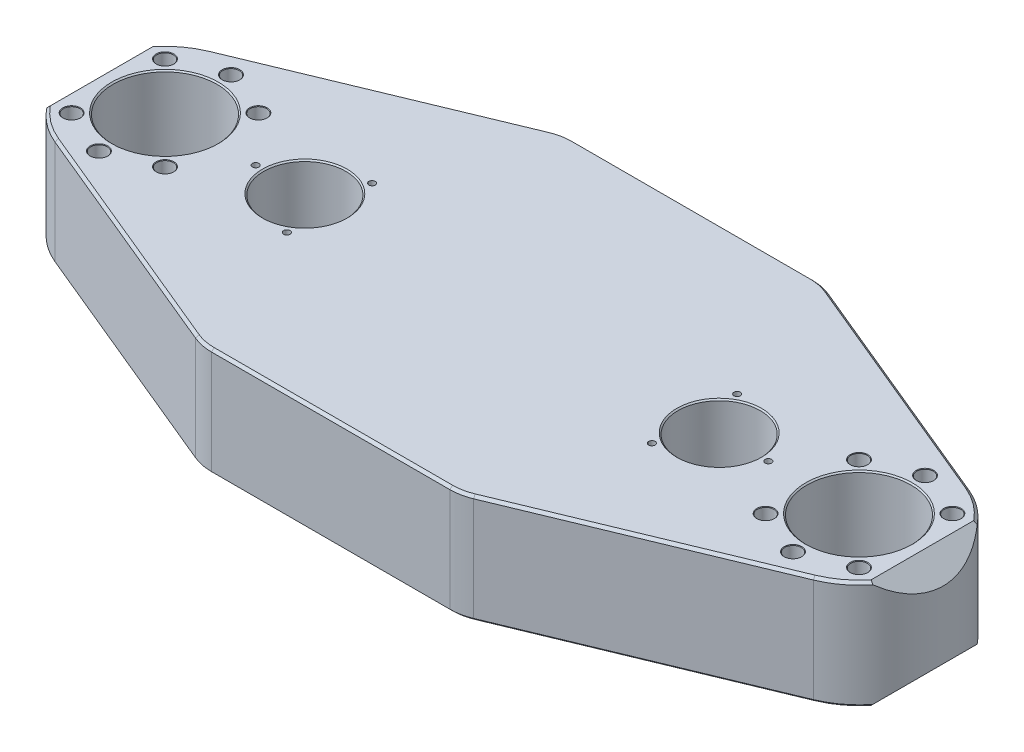
from build123d import *

# Parameters (mm, degrees)
SKETCH1_R                      = 20.1
SKETCH1_R_2                    = 15.875
BOSS_EXTRUDE1_DEPTH            = 21
CUT_EXTRUDE3_DEPTH             = 182.833027803
MIRROR2_COPY_1_DEPTH           = 182.833027803
M6_CLEARANCE_HOLE1_D           = 6.4
CHAMFER2_SIZE                  = 0.5
CHAMFER5_SIZE                  = 1
CHAMFER6_SIZE                  = 0.5
M3X0_5_TAPPED_HOLE1_AT_2_COUNT = 2
M3X0_5_TAPPED_HOLE1_AT_2_PITCH = 32.908965344
M3X0_5_TAPPED_HOLE1_AT_3_COUNT = 2
M3X0_5_TAPPED_HOLE1_AT_3_PITCH = 32.908965344
CHAMFER9_SIZE                  = 0.2


with BuildPart() as part:
    # Sketch1 → Boss-Extrude1 (new, symmetric)
    with BuildSketch(Plane(origin=(0, 0, 0), x_dir=(1, 0, 0), z_dir=(0, 1, 0))):
        with BuildLine():
            Line((-146.444734798, 30.022967472), (-53.677446084, 68.47567229))
            ThreePointArc((-53.677446084, 68.47567229), (-49.92341171, 69.615216616), (-46.019147746, 70))
            Line((-46.019147746, 70), (46.019147746, 70))
            ThreePointArc((46.019147746, 70), (49.92341171, 69.615216616), (53.677446084, 68.47567229))
            Line((53.677446084, 68.47567229), (146.444734798, 30.022967472))
            ThreePointArc((146.444734798, 30.022967472), (166.5, 0), (146.444734798, -30.022967472))
            Line((146.444734798, -30.022967472), (53.677446084, -68.47567229))
            ThreePointArc((53.677446084, -68.47567229), (49.92341171, -69.615216616), (46.019147746, -70))
            Line((46.019147746, -70), (-46.019147746, -70))
            ThreePointArc((-46.019147746, -70), (-49.92341171, -69.615216616), (-53.677446084, -68.47567229))
            Line((-53.677446084, -68.47567229), (-146.444734798, -30.022967472))
            ThreePointArc((-146.444734798, -30.022967472), (-166.5, 0), (-146.444734798, 30.022967472))
        make_face()
        with Locations(Location((-134, 0, 0), (0, 0, 90))):
            Circle(SKETCH1_R, mode=Mode.SUBTRACT)
        with Locations(Location((134, 0, 0), (0, 0, 90))):
            Circle(SKETCH1_R, mode=Mode.SUBTRACT)
        with Locations(Location((-80, 0, 0), (0, 0, 90))):
            Circle(SKETCH1_R_2, mode=Mode.SUBTRACT)
        with Locations(Location((80, 0, 0), (0, 0, 90))):
            Circle(SKETCH1_R_2, mode=Mode.SUBTRACT)
    extrude(amount=BOSS_EXTRUDE1_DEPTH, both=True)

    # Sketch5 → Cut-Extrude3 (cut, symmetric)
    with BuildSketch(Plane.XY):
        Polygon((158.5, -21), (166.5, -13), (166.5, -21), align=None)
    cut_extrude3 = extrude(amount=CUT_EXTRUDE3_DEPTH, both=True, mode=Mode.SUBTRACT)

    # Mirror1: Cut-Extrude3 across plane
    add(cut_extrude3.mirror(Plane.ZX), mode=Mode.SUBTRACT)

    # Mirror2: Cut-Extrude3 across plane
    add(cut_extrude3.mirror(Plane(origin=(0, 0, 0), x_dir=(0, 0, 1), z_dir=(1, 0, 0))), mode=Mode.SUBTRACT)

    # Mirror2 copy 1 sketch → Mirror2 copy 1 (cut, symmetric)
    with BuildSketch(Plane(origin=(0, 0, 0), x_dir=(-1, 0, 0), z_dir=(0, 0, 1))):
        Polygon((158.5, -21), (166.5, -13), (166.5, -21), align=None)
    extrude(amount=MIRROR2_COPY_1_DEPTH, both=True, mode=Mode.SUBTRACT)

    # M6 Clearance Hole1 (through all)
    with Locations(Plane(origin=(0, -21, 0), x_dir=(-1, 0, 0), z_dir=(0, -1, 0))):
        with Locations((-115.96877708, -18.03122292), (-134, -25.5), (-152.03122292, -18.03122292), (-152.03122292, 18.03122292), (-134, 25.5), (-115.96877708, 18.03122292)):
            m6_clearance_hole1 = Hole(M6_CLEARANCE_HOLE1_D / 2)

    # Mirror5: M6 Clearance Hole1 across plane
    add(m6_clearance_hole1.mirror(Plane(origin=(0, 0, 0), x_dir=(0, 0, 1), z_dir=(1, 0, 0))), mode=Mode.SUBTRACT)

    # Chamfer2
    chamfer2_edges = [part.edges().sort_by_distance(p)[0] for p in [
        (-134, -21, 20.1),
        (-134, 21, 20.1),
        (134, -21, 20.1),
        (134, 21, 20.1),
    ]]
    chamfer(chamfer2_edges, length=CHAMFER2_SIZE)

    # Chamfer5
    chamfer5_edges = [part.edges().sort_by_distance(p)[0] for p in [
        (152.974072526, -21, -26.386257252),
        (-152.974072526, -21, -26.386257252),
        (100.061090441, -21, -49.249319881),
        (-100.061090441, -21, -49.249319881),
        (49.92341171, -21, -69.615216616),
        (-49.92341171, -21, -69.615216616),
        (0, -21, -70),
        (-152.974072526, -21, 26.386257252),
        (152.974072526, -21, 26.386257252),
        (-100.061090441, -21, 49.249319881),
        (100.061090441, -21, 49.249319881),
        (-49.92341171, -21, 69.615216616),
        (49.92341171, -21, 69.615216616),
        (0, -21, 70),
        (152.974072526, 21, -26.386257252),
        (-152.974072526, 21, -26.386257252),
        (100.061090441, 21, -49.249319881),
        (-100.061090441, 21, -49.249319881),
        (49.92341171, 21, -69.615216616),
        (-49.92341171, 21, -69.615216616),
        (0, 21, -70),
        (-152.974072526, 21, 26.386257252),
        (152.974072526, 21, 26.386257252),
        (-100.061090441, 21, 49.249319881),
        (100.061090441, 21, 49.249319881),
        (-49.92341171, 21, 69.615216616),
        (49.92341171, 21, 69.615216616),
        (0, 21, 70),
    ]]
    chamfer(chamfer5_edges, length=CHAMFER5_SIZE)

    # Chamfer6
    chamfer6_edges = [part.edges().sort_by_distance(p)[0] for p in [
        (-80, -21, 15.875),
        (-80, 21, 15.875),
        (80, -21, 15.875),
        (80, 21, 15.875),
    ]]
    chamfer(chamfer6_edges, length=CHAMFER6_SIZE)

    # Sketch13 → M3x0.5 Tapped Hole1 (revolve, cut)
    with BuildSketch(Plane(origin=(99, 21, 0), x_dir=(0, 0, 1), z_dir=(1, 0, 0))):
        Polygon((0, 0), (0, 8.251075774), (1.25, 7.5), (1.25, 0), align=None)
    m3x0_5_tapped_hole1 = revolve(axis=Axis((99, 27.35, 0), (0, -1, 0)), mode=Mode.SUBTRACT)

    # M3x0.5 Tapped Hole1 at 2: M3x0.5 Tapped Hole1 ×2
    with Locations(*[Vector(-0.8660254037844387, 0, 0.5000000000000001) * (i * M3X0_5_TAPPED_HOLE1_AT_2_PITCH) for i in range(1, M3X0_5_TAPPED_HOLE1_AT_2_COUNT)]):
        add(m3x0_5_tapped_hole1, mode=Mode.SUBTRACT)

    # M3x0.5 Tapped Hole1 at 3: M3x0.5 Tapped Hole1 ×2
    with Locations(*[Vector(-0.8660254037844387, 0, -0.5000000000000001) * (i * M3X0_5_TAPPED_HOLE1_AT_3_PITCH) for i in range(1, M3X0_5_TAPPED_HOLE1_AT_3_COUNT)]):
        add(m3x0_5_tapped_hole1, mode=Mode.SUBTRACT)

    # Mirror6: M3x0.5 Tapped Hole1 across plane
    add(m3x0_5_tapped_hole1.mirror(Plane(origin=(0, 0, 0), x_dir=(0, 0, 1), z_dir=(1, 0, 0))), mode=Mode.SUBTRACT)

    # Mirror6 copy 1 sketch → Mirror6 copy 1 (revolve, cut)
    with BuildSketch(Plane(origin=(-70.5, 21, 16.454482672), x_dir=(0, 0, 1), z_dir=(-1, 0, 0))):
        Polygon((0, 0), (0, -8.251075774), (1.25, -7.5), (1.25, 0), align=None)
    revolve(axis=Axis((-70.5, 27.35, 16.454482672), (0, 1, 0)), mode=Mode.SUBTRACT)

    # Mirror6 copy 2 sketch → Mirror6 copy 2 (revolve, cut)
    with BuildSketch(Plane(origin=(-70.5, 21, -16.454482672), x_dir=(0, 0, 1), z_dir=(-1, 0, 0))):
        Polygon((0, 0), (0, -8.251075774), (1.25, -7.5), (1.25, 0), align=None)
    revolve(axis=Axis((-70.5, 27.35, -16.454482672), (0, 1, 0)), mode=Mode.SUBTRACT)

    # Mirror7: M3x0.5 Tapped Hole1 across plane
    add(m3x0_5_tapped_hole1.mirror(Plane.ZX), mode=Mode.SUBTRACT)

    # Mirror7 copy 1 sketch → Mirror7 copy 1 (revolve, cut)
    with BuildSketch(Plane(origin=(70.5, -21, 16.454482672), x_dir=(0, 0, 1), z_dir=(1, 0, 0))):
        Polygon((0, 0), (0, -8.251075774), (1.25, -7.5), (1.25, 0), align=None)
    revolve(axis=Axis((70.5, -27.35, 16.454482672), (0, -1, 0)), mode=Mode.SUBTRACT)

    # Mirror7 copy 2 sketch → Mirror7 copy 2 (revolve, cut)
    with BuildSketch(Plane(origin=(70.5, -21, -16.454482672), x_dir=(0, 0, 1), z_dir=(1, 0, 0))):
        Polygon((0, 0), (0, -8.251075774), (1.25, -7.5), (1.25, 0), align=None)
    revolve(axis=Axis((70.5, -27.35, -16.454482672), (0, -1, 0)), mode=Mode.SUBTRACT)

    # Mirror7 copy 3 sketch → Mirror7 copy 3 (revolve, cut)
    with BuildSketch(Plane(origin=(-99, -21, 0), x_dir=(0, 0, 1), z_dir=(-1, 0, 0))):
        Polygon((0, 0), (0, 8.251075774), (1.25, 7.5), (1.25, 0), align=None)
    revolve(axis=Axis((-99, -27.35, 0), (0, 1, 0)), mode=Mode.SUBTRACT)

    # Mirror7 copy 4 sketch → Mirror7 copy 4 (revolve, cut)
    with BuildSketch(Plane(origin=(-70.5, -21, 16.454482672), x_dir=(0, 0, 1), z_dir=(-1, 0, 0))):
        Polygon((0, 0), (0, 8.251075774), (1.25, 7.5), (1.25, 0), align=None)
    revolve(axis=Axis((-70.5, -27.35, 16.454482672), (0, 1, 0)), mode=Mode.SUBTRACT)

    # Mirror7 copy 5 sketch → Mirror7 copy 5 (revolve, cut)
    with BuildSketch(Plane(origin=(-70.5, -21, -16.454482672), x_dir=(0, 0, 1), z_dir=(-1, 0, 0))):
        Polygon((0, 0), (0, 8.251075774), (1.25, 7.5), (1.25, 0), align=None)
    revolve(axis=Axis((-70.5, -27.35, -16.454482672), (0, 1, 0)), mode=Mode.SUBTRACT)

    # Chamfer9
    chamfer9_edges = [part.edges().sort_by_distance(p)[0] for p in [
        (112.76877708, -21, -18.03122292),
        (112.76877708, 21, -18.03122292),
        (130.8, -21, -25.5),
        (130.8, 21, -25.5),
        (148.83122292, -21, -18.03122292),
        (148.83122292, 21, -18.03122292),
        (148.83122292, -21, 18.03122292),
        (148.83122292, 21, 18.03122292),
        (130.8, -21, 25.5),
        (130.8, 21, 25.5),
        (112.76877708, -21, 18.03122292),
        (112.76877708, 21, 18.03122292),
        (-112.76877708, -21, -18.03122292),
        (-112.76877708, 21, -18.03122292),
        (-130.8, -21, -25.5),
        (-130.8, 21, -25.5),
        (-148.83122292, -21, -18.03122292),
        (-148.83122292, 21, -18.03122292),
        (-148.83122292, -21, 18.03122292),
        (-148.83122292, 21, 18.03122292),
        (-130.8, -21, 25.5),
        (-130.8, 21, 25.5),
        (-112.76877708, -21, 18.03122292),
        (-112.76877708, 21, 18.03122292),
    ]]
    chamfer(chamfer9_edges, length=CHAMFER9_SIZE)


solid = part.part
